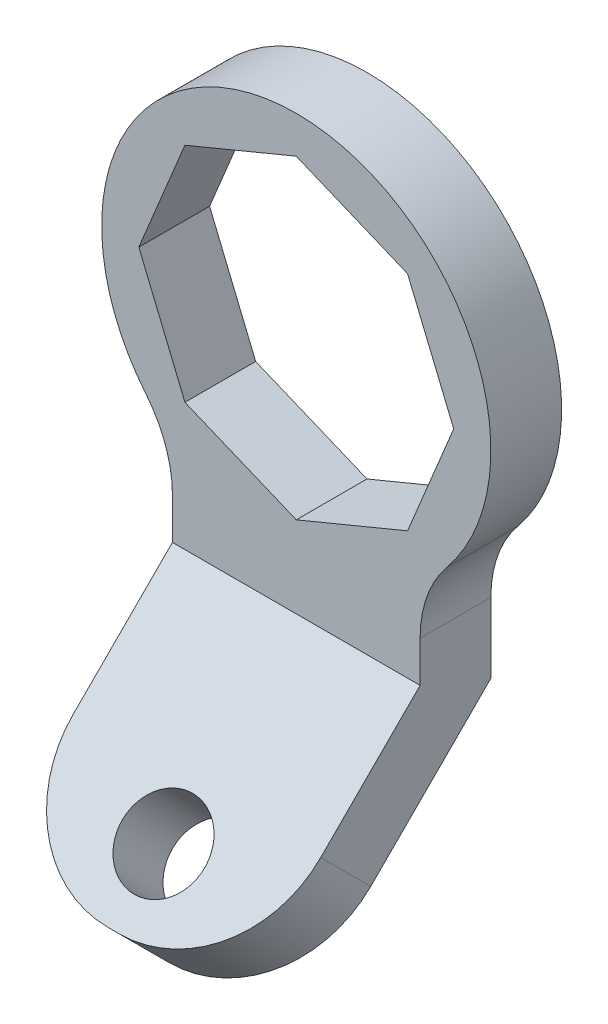
from build123d import *

# Parameters (mm, degrees)
SKETCH_1_R               = 16.5
EXTRUDE_1_DEPTH          = 6
EXTRUDE_START            = -6
EXTRUDE_2_DEPTH          = 6
EXTRUDE_3_DEPTH          = 21
SKETCH_4_R               = 3.5
CUT_EXTRUDE_1_DEPTH      = 47.608743815
CUT_EXTRUDE_3_DEPTH      = 53.832281798
CUT_EXTRUDE_3_DEPTH_BACK = 53.832281798
EXTRUDE_4_DEPTH          = 21
FILLET_3_R               = 10


with BuildPart() as part:
    # 草图1 → 凸台-拉伸1 (new body)
    with BuildSketch(Plane.XY):
        Circle(SKETCH_1_R)
        Polygon((13.35, 0), (9.439875529, -9.439875529), (0, -13.35), (-9.439875529, -9.439875529), (-13.35, 0), (-9.439875529, 9.439875529), (0, 13.35), (9.439875529, 9.439875529), align=None, mode=Mode.SUBTRACT)
    extrude(amount=EXTRUDE_1_DEPTH)

    # 草图2 → 凸台-拉伸2 (add)
    with BuildSketch(Plane.XY.offset(6).offset(EXTRUDE_START)):
        with BuildLine():
            Line((-10.5, -12.727922061), (-10.5, -30))
            Line((-10.5, -30), (10.5, -30))
            Line((10.5, -30), (10.5, -12.727922061))
            ThreePointArc((10.5, -12.727922061), (0, -16.5), (-10.5, -12.727922061))
        make_face()
    extrude(amount=EXTRUDE_2_DEPTH)

    # 草图3 → 凸台-拉伸3 (add)
    with BuildSketch(Plane(origin=(10.5, 0, 0), x_dir=(0, 0, -1), z_dir=(1, 0, 0))):
        Polygon((-6, -24), (-9.742640687, -24), (-15.742640687, -30), (-7.257359313, -30), (-6, -28.742640687), align=None)
        Polygon((-6, -30), (-6, -28.742640687), (-7.257359313, -30), align=None)
        Polygon((-7.257359313, -30), (-15.742640687, -30), (-21.5, -35.757359313), (-17.257359313, -40), align=None)
    extrude(amount=-EXTRUDE_3_DEPTH)

    # 草图4 → 切除-拉伸1 (cut, through all)
    with BuildSketch(Plane(origin=(0, -7.128679656, -7.128679656), x_dir=(1, 0, 0), z_dir=(0, 0.7071067811865438, 0.7071067811865513))):
        with Locations(Location((0, -34.487067043, 0), (0, 0, 270))):
            Circle(SKETCH_4_R)
    extrude(amount=-CUT_EXTRUDE_1_DEPTH, mode=Mode.SUBTRACT)

    # 草图5 → 切除-拉伸3 (cut, two sides: drawn at the far end of the back side and taken through both)
    with BuildSketch(Plane(origin=(10.5, 0, 0), x_dir=(0, 0, -1), z_dir=(1, 0, 0)).offset(-CUT_EXTRUDE_3_DEPTH_BACK)):
        Polygon((0, -22.742640687), (-7.257359313, -30), (0, -30), align=None)
    extrude(amount=CUT_EXTRUDE_3_DEPTH + CUT_EXTRUDE_3_DEPTH_BACK, mode=Mode.SUBTRACT)

    # 草图6 → 凸台-拉伸4 (add)
    with BuildSketch(Plane(origin=(10.5, 0, 0), x_dir=(0, 0, -1), z_dir=(1, 0, 0))):
        Polygon((-6, -20.257359313), (-9.742640687, -24), (-6, -24), align=None)
    extrude(amount=-EXTRUDE_4_DEPTH)

    # 圆角3
    fillet_3_edges = [part.edges().sort_by_distance(p)[0] for p in [
        (-10.5, -12.727922061, 3),
        (10.5, -12.727922061, 3),
        (-10.5, -37.878679656, 19.378679656),
        (10.5, -37.878679656, 19.378679656),
    ]]
    fillet(fillet_3_edges, radius=FILLET_3_R)


solid = part.part
